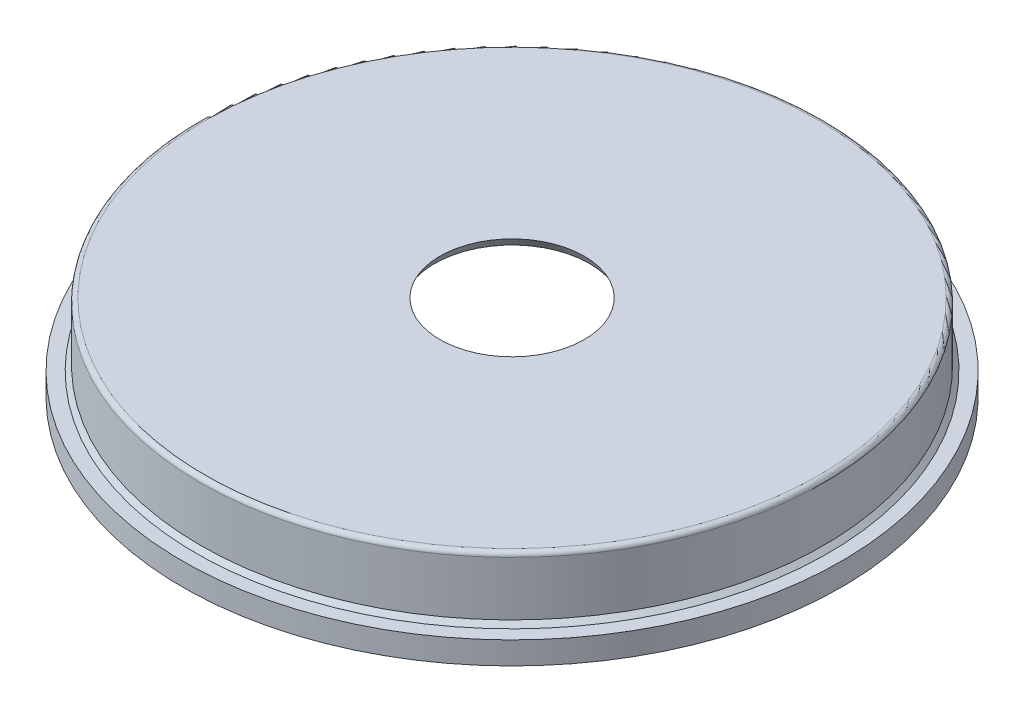
from build123d import *


with BuildPart() as part:
    # Schizzo1 → Rivoluzione1 (revolve)
    with BuildSketch(Plane(origin=(0, 0, 0), x_dir=(0, 0, -1), z_dir=(1, 0, 0)), mode=Mode.PRIVATE) as rivoluzione1_sk:
        with BuildLine():
            Line((-73, 0), (-72, 0))
            Line((-72, 0), (-72, 3))
            Line((-72, 3), (-67, 3))
            Line((-67, 3), (-67, 17))
            Line((-67, 17), (-17.154700538, 17))
            Line((-17.154700538, 17), (-16, 19))
            Line((-16, 19), (-68, 19))
            ThreePointArc((-68, 19), (-68.707106781, 18.707106781), (-69, 18))
            Line((-69, 18), (-69, 6))
            Line((-69, 6), (-70, 5))
            Line((-70, 5), (-73, 5))
            Line((-73, 5), (-73, 0))
        make_face()
    revolve(rivoluzione1_sk.sketch.rotate(Axis((0, 0, 0), (0, 1, 0)), 180), axis=Axis((0, 0, 0), (0, 1, 0)))


solid = part.part
